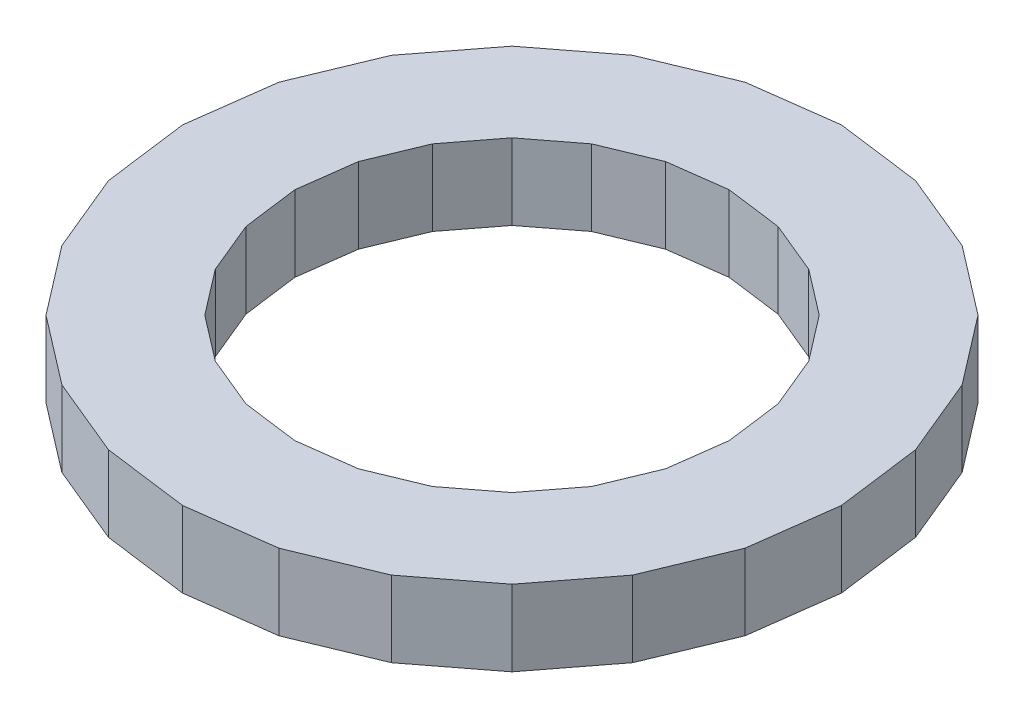
from build123d import *

# Parameters (mm, degrees)
BOSS_EXTRUDE3_DEPTH = 19.05


with BuildPart() as part:
    # Sketch3 → Boss-Extrude3 (new body)
    with BuildSketch(Plane(origin=(0, 0, 0), x_dir=(1, 0, 0), z_dir=(0, 1, 0))):
        Polygon((-82.703707328, 0), (-79.885646838, -21.405294557), (-71.623511533, -41.351853664), (-58.480352281, -58.480352281), (-41.351853664, -71.623511533), (-21.405294557, -79.885646838), (0, -82.703707328), (21.405294557, -79.885646838), (41.351853664, -71.623511533), (58.480352281, -58.480352281), (71.623511533, -41.351853664), (79.885646838, -21.405294557), (82.703707328, 0), (79.885646838, 21.405294557), (71.623511533, 41.351853664), (58.480352281, 58.480352281), (41.351853664, 71.623511533), (21.405294557, 79.885646838), (0, 82.703707328), (-21.405294557, 79.885646838), (-41.351853664, 71.623511533), (-58.480352281, 58.480352281), (-71.623511533, 41.351853664), (-79.885646838, 21.405294557), align=None)
        Polygon((-54.522614169, 0), (-52.664801143, -14.111490936), (-47.217968951, -27.261307085), (-38.553310207, -38.553310207), (-27.261307085, -47.217968951), (-14.111490936, -52.664801143), (0, -54.522614169), (14.111490936, -52.664801143), (27.261307085, -47.217968951), (38.553310207, -38.553310207), (47.217968951, -27.261307085), (52.664801143, -14.111490936), (54.522614169, 0), (52.664801143, 14.111490936), (47.217968951, 27.261307085), (38.553310207, 38.553310207), (27.261307085, 47.217968951), (14.111490936, 52.664801143), (0, 54.522614169), (-14.111490936, 52.664801143), (-27.261307085, 47.217968951), (-38.553310207, 38.553310207), (-47.217968951, 27.261307085), (-52.664801143, 14.111490936), align=None, mode=Mode.SUBTRACT)
    extrude(amount=BOSS_EXTRUDE3_DEPTH)


solid = part.part
